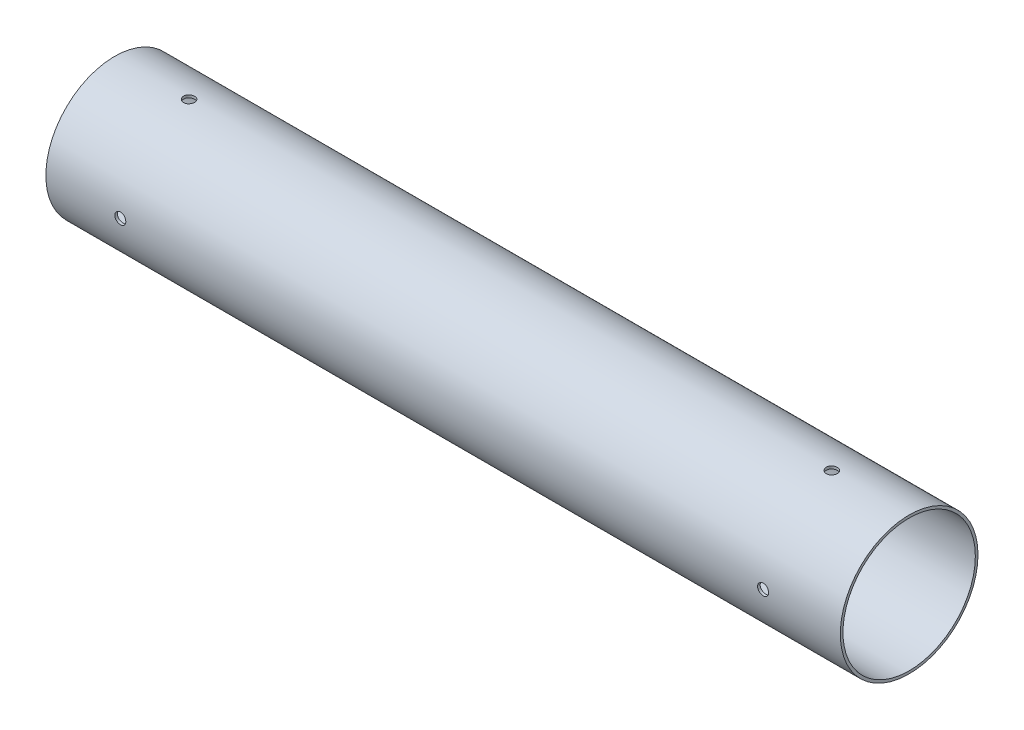
from build123d import *

# Parameters (mm, degrees)
SKETCH1_R           = 39.624
SKETCH1_R_2         = 38.1
BOSS_EXTRUDE1_DEPTH = 457.2
SKETCH2_R           = 3.175
CUT_EXTRUDE1_DEPTH  = 461.621279092
CIRPATTERN1_COUNT   = 4
SKETCH3_R           = 3.175
CUT_EXTRUDE2_DEPTH  = 461.621279208
CIRPATTERN2_COUNT   = 4


with BuildPart() as part:
    # Sketch1 → Boss-Extrude1 (new body)
    with BuildSketch(Plane.YZ):
        with Locations(Location((0, 0, 0), (0, 0, 270))):
            Circle(SKETCH1_R)
        with Locations(Location((0, 0, 0), (0, 0, 270))):
            Circle(SKETCH1_R_2, mode=Mode.SUBTRACT)
    extrude(amount=BOSS_EXTRUDE1_DEPTH)

    # Sketch2 → Cut-Extrude1 (cut, through all)
    with BuildSketch(Plane(origin=(0, 0, 0), x_dir=(-1, 0, 0), z_dir=(0, 1, 0))):
        with Locations(Location((-42.8244, 0, 0), (0, 0, 270))):
            Circle(SKETCH2_R)
    cut_extrude1 = extrude(amount=CUT_EXTRUDE1_DEPTH, mode=Mode.SUBTRACT)

    # CirPattern1: Cut-Extrude1 ×4 about axis
    cirpattern1_axis = Axis((457.2, 0, 0), (-1, 0, 0))
    for i in range(1, CIRPATTERN1_COUNT):
        add(cut_extrude1.rotate(cirpattern1_axis, i * 360 / CIRPATTERN1_COUNT), mode=Mode.SUBTRACT)

    # Sketch3 → Cut-Extrude2 (cut, through all)
    with BuildSketch(Plane(origin=(0, 0, 0), x_dir=(-1, 0, 0), z_dir=(0, 1, 0))):
        with Locations(Location((-412.75, 0, 0), (0, 0, 270))):
            Circle(SKETCH3_R)
    cut_extrude2 = extrude(amount=CUT_EXTRUDE2_DEPTH, mode=Mode.SUBTRACT)

    # CirPattern2: Cut-Extrude2 ×4 about axis
    cirpattern2_axis = Axis((457.2, 0, 0), (-1, 0, 0))
    for i in range(1, CIRPATTERN2_COUNT):
        add(cut_extrude2.rotate(cirpattern2_axis, i * 360 / CIRPATTERN2_COUNT), mode=Mode.SUBTRACT)


solid = part.part
